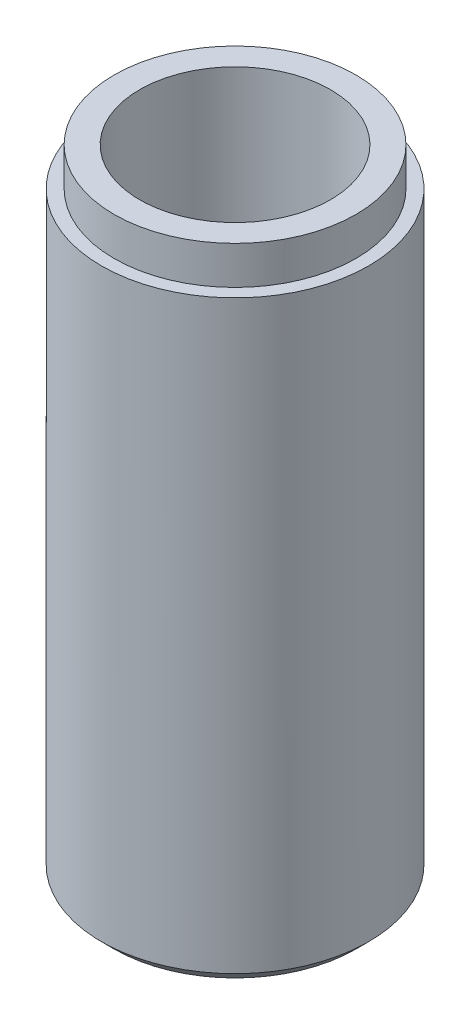
from build123d import *

# Parameters (mm, degrees)
SKETCH_1_W          = 3
SKETCH_1_H          = 50
CHAMFER_1_SIZE      = 1
SKETCH_2_OUTSIDE_W  = 34.63
SKETCH_2_OUTSIDE_H  = 34.63
SKETCH_2_OUTSIDE_R  = 9.5
CUT_EXTRUDE_1_DEPTH = 3


with BuildPart() as part:
    # Эскиз1 → Повернуть1 (revolve)
    with BuildSketch(Plane.XY, mode=Mode.PRIVATE) as revolve_1_sk:
        with Locations((9, 25)):
            Rectangle(SKETCH_1_W, SKETCH_1_H)
    revolve(revolve_1_sk.sketch.rotate(Axis((0, 0, 0), (0, 1, 0)), 90), axis=Axis((0, 0, 0), (0, 1, 0)))

    # Фаска1
    chamfer_1_edges = [part.edges().sort_by_distance(p)[0] for p in [
        (0, 0, 10.5),
    ]]
    chamfer(chamfer_1_edges, length=CHAMFER_1_SIZE)

    # Эскиз2 outside → Вытянуть1 (cut)
    with BuildSketch(Plane(origin=(0, 50, 0), x_dir=(1, 0, 0), z_dir=(0, 1, 0))):
        Rectangle(SKETCH_2_OUTSIDE_W, SKETCH_2_OUTSIDE_H)
        with Locations(Location((0, 0, 0), (0, 0, 270))):
            Circle(SKETCH_2_OUTSIDE_R, mode=Mode.SUBTRACT)
    extrude(amount=-CUT_EXTRUDE_1_DEPTH, mode=Mode.SUBTRACT)


solid = part.part
